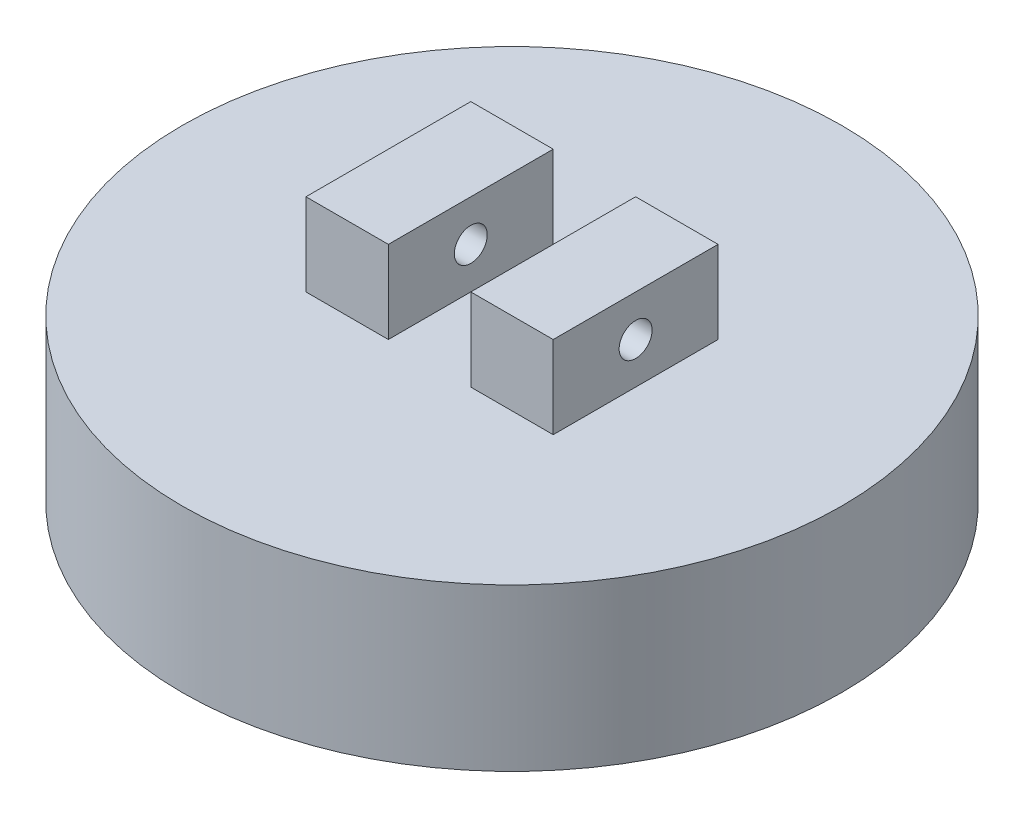
from build123d import *

# Parameters (mm, degrees)
CROQUIS2_R              = 20
SALIENTE_EXTRUIR1_DEPTH = 9.8
CROQUIS3_W              = 5
CROQUIS3_H              = 10
SALIENTE_EXTRUIR2_DEPTH = 5
CROQUIS4_R              = 1
CORTAR_EXTRUIR1_DEPTH   = 38.084902589


with BuildPart() as part:
    # Croquis2 → Saliente-Extruir1 (new body)
    with BuildSketch(Plane(origin=(0, 0, 0), x_dir=(1, 0, 0), z_dir=(0, 1, 0))):
        with Locations(Location((0, 0, 0), (0, 0, 270))):
            Circle(CROQUIS2_R)
    extrude(amount=SALIENTE_EXTRUIR1_DEPTH)

    # Croquis3 → Saliente-Extruir2 (add)
    with BuildSketch(Plane(origin=(0, 9.8, 0), x_dir=(1, 0, 0), z_dir=(0, 1, 0))):
        with Locations((5, 0)):
            Rectangle(CROQUIS3_W, CROQUIS3_H)
        with Locations((-5, 0)):
            Rectangle(CROQUIS3_W, CROQUIS3_H)
    extrude(amount=SALIENTE_EXTRUIR2_DEPTH)

    # Croquis4 → Cortar-Extruir1 (cut, through all)
    with BuildSketch(Plane.ZY.offset(7.5)):
        with Locations((0, 12.3)):
            Circle(CROQUIS4_R)
    extrude(amount=-CORTAR_EXTRUIR1_DEPTH, mode=Mode.SUBTRACT)


solid = part.part
